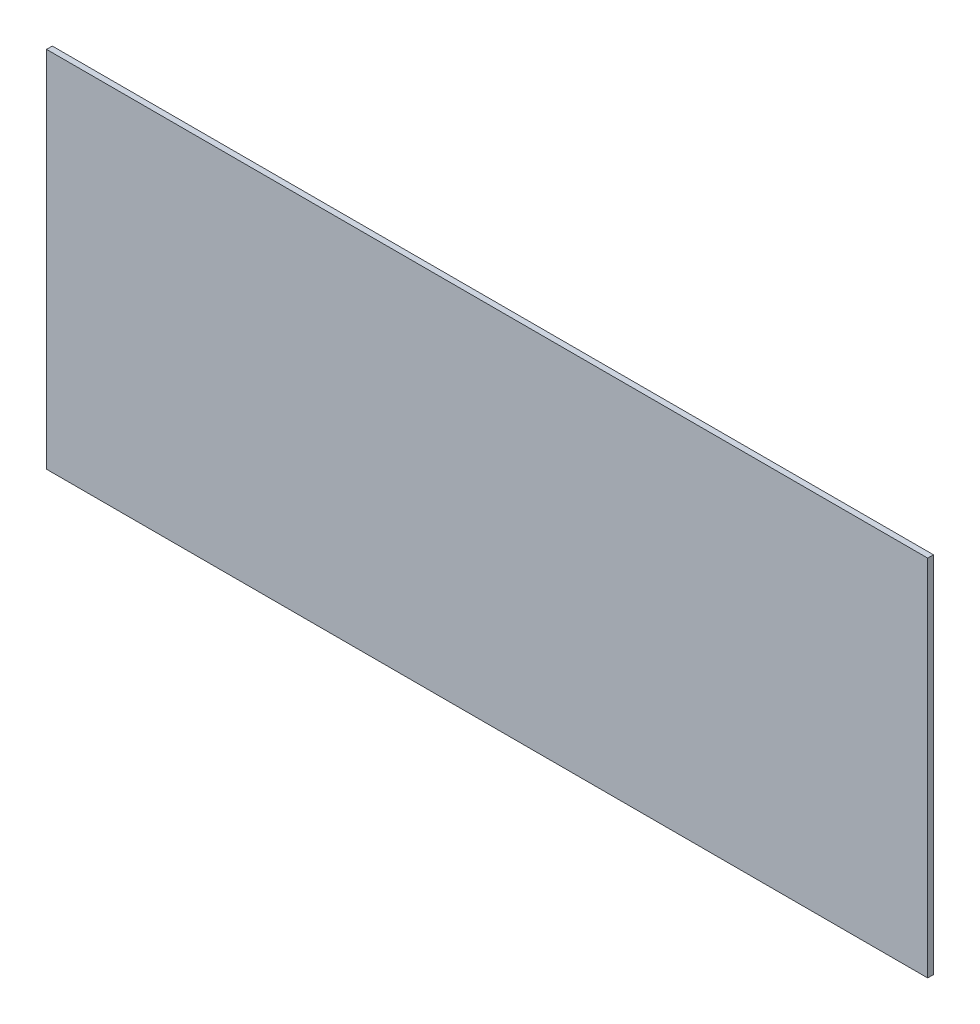
from build123d import *

# Parameters (mm, degrees)
SKETCH1_W           = 305
SKETCH1_H           = 100
BOSS_EXTRUDE1_DEPTH = 2
SKETCH2_W           = 305
SKETCH2_H           = 2
BOSS_EXTRUDE2_DEPTH = 25.859811782


with BuildPart() as part:
    # Sketch1 → Boss-Extrude1 (new body)
    with BuildSketch(Plane(origin=(0, 0, 0), x_dir=(-1, 0, 0), z_dir=(0, 0, -1))):
        with Locations((38.5, -271.43902439)):
            Rectangle(SKETCH1_W, SKETCH1_H)
    extrude(amount=-BOSS_EXTRUDE1_DEPTH)

    # Sketch2 → Boss-Extrude2 (add)
    with BuildSketch(Plane(origin=(0, -221.43902439, 0), x_dir=(1, 0, 0), z_dir=(0, 1, 0))):
        with Locations((-38.5, -1)):
            Rectangle(SKETCH2_W, SKETCH2_H)
    extrude(amount=BOSS_EXTRUDE2_DEPTH)


solid = part.part
